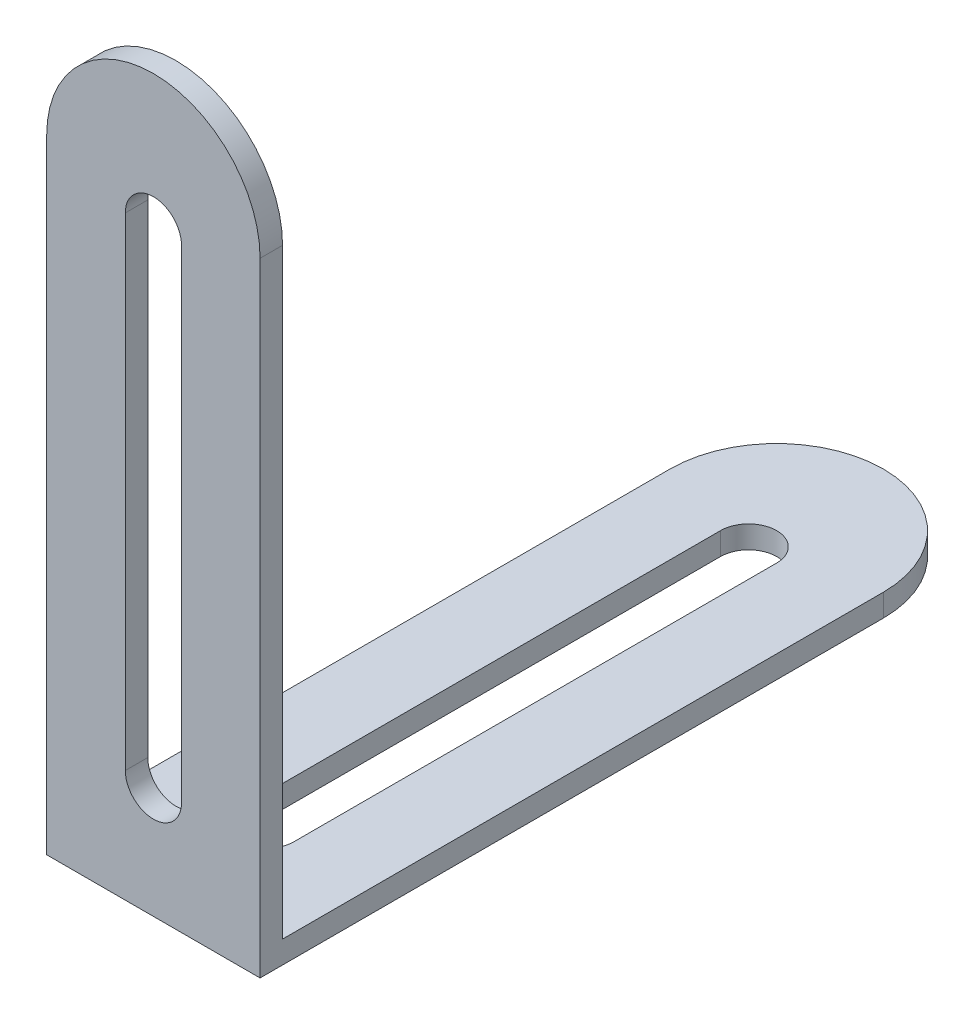
from build123d import *

# Parameters (mm, degrees)
SKETCH_1_W      = 19
SKETCH_1_H      = 2.5
EXTRUDE_1_DEPTH = 2
EXTRUDE_2_DEPTH = 2


with BuildPart() as part:
    # 草图1 → 凸台-拉伸1 (new body)
    # profile 1 of 2: a face of its own
    with BuildSketch(Plane.XY):
        with BuildLine():
            Line((-9.5, 55.5), (-9.5, 2.5))
            Line((-9.5, 2.5), (9.5, 2.5))
            Line((9.5, 2.5), (9.5, 55.5))
            ThreePointArc((9.5, 55.5), (0, 65), (-9.5, 55.5))
        make_face()
        with BuildLine():
            ThreePointArc((-2.5, 53), (0, 55.5), (2.5, 53))
            Line((2.5, 53), (2.5, 10))
            ThreePointArc((2.5, 10), (0, 7.5), (-2.5, 10))
            Line((-2.5, 10), (-2.5, 53))
        make_face(mode=Mode.SUBTRACT)
    # profile 2 of 2: a face of its own
    with BuildSketch(Plane.XY):
        with Locations((0, 1.25)):
            Rectangle(SKETCH_1_W, SKETCH_1_H)
    extrude(amount=EXTRUDE_1_DEPTH)

    # 草图2 → 凸台-拉伸2 (add)
    with BuildSketch(Plane(origin=(0, 0, 0), x_dir=(1, 0, 0), z_dir=(0, 1, 0))):
        with BuildLine():
            Line((-9.5, -2), (9.5, -2))
            Line((9.5, -2), (9.5, 53.5))
            ThreePointArc((9.5, 53.5), (0, 63), (-9.5, 53.5))
            Line((-9.5, 53.5), (-9.5, -2))
        make_face()
        with BuildLine():
            Line((-2.5, 8), (-2.5, 51))
            ThreePointArc((-2.5, 51), (0, 53.5), (2.5, 51))
            Line((2.5, 51), (2.5, 8))
            ThreePointArc((2.5, 8), (0, 5.5), (-2.5, 8))
        make_face(mode=Mode.SUBTRACT)
    extrude(amount=EXTRUDE_2_DEPTH)


solid = part.part
